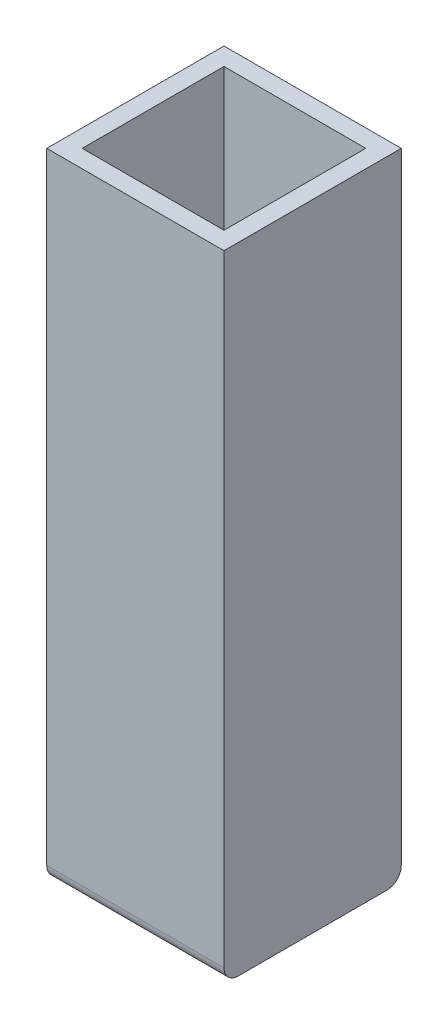
from build123d import *

# Parameters (mm, degrees)
SKETCH_1_W          = 12.5
SKETCH_1_H          = 12.5
EXTRUDE_1_DEPTH     = 44.8
SKETCH_2_W          = 10
SKETCH_2_H          = 10
CUT_EXTRUDE_1_DEPTH = 44
FILLET_1_R          = 1


with BuildPart() as part:
    # Эскиз1 → Бобышка-Вытянуть1 (new body)
    with BuildSketch(Plane(origin=(0, 0, 0), x_dir=(1, 0, 0), z_dir=(0, 1, 0))):
        with Locations((6.25, 6.25)):
            Rectangle(SKETCH_1_W, SKETCH_1_H)
    extrude(amount=EXTRUDE_1_DEPTH)

    # Эскиз2 → Вырез-Вытянуть1 (cut)
    with BuildSketch(Plane(origin=(0, 44.8, 0), x_dir=(1, 0, 0), z_dir=(0, 1, 0))):
        with Locations((6.25, 6.25)):
            Rectangle(SKETCH_2_W, SKETCH_2_H)
    extrude(amount=-CUT_EXTRUDE_1_DEPTH, mode=Mode.SUBTRACT)

    # Скругление1
    fillet_1_edges = [part.edges().sort_by_distance(p)[0] for p in [
        (6.25, 0, -12.5),
        (6.25, 0, 0),
    ]]
    fillet(fillet_1_edges, radius=FILLET_1_R)


solid = part.part
